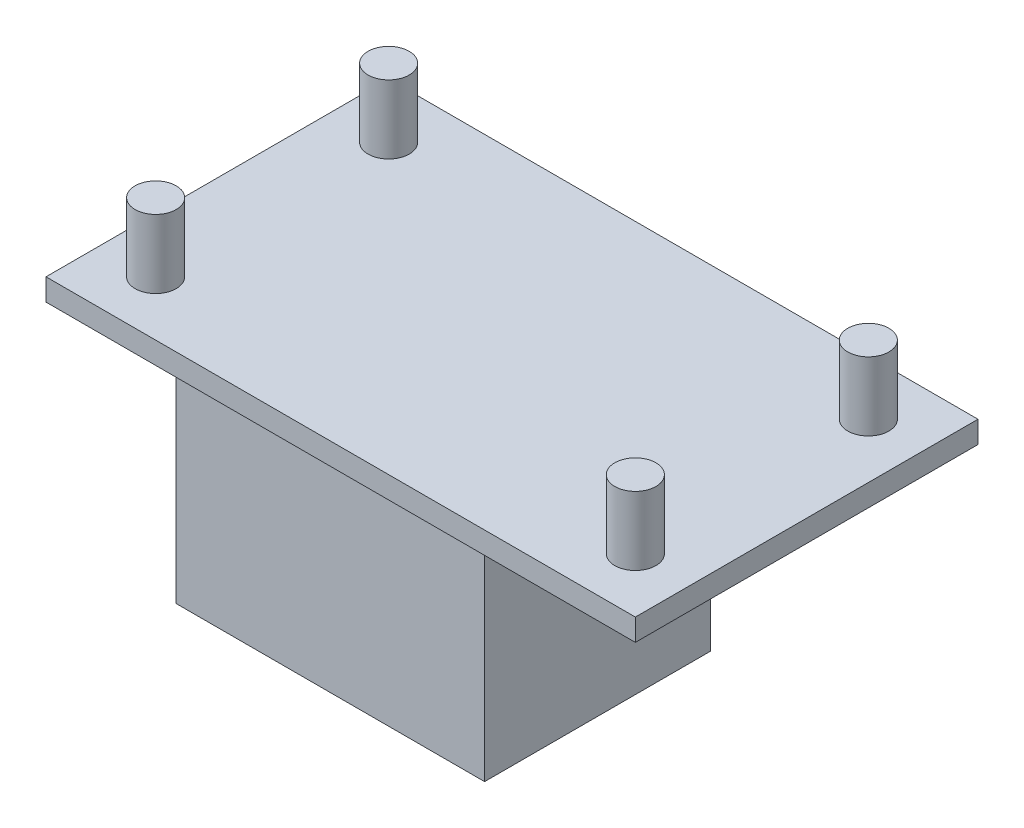
from build123d import *

# Parameters (mm, degrees)
P01_STANDOFF_START                = 20.4
SK_P01_STANDOFF_R                 = 1.5
P01_STANDOFF_DEPTH                = 5
P02_STANDOFF_START                = 20.4
SK_P02_STANDOFF_R                 = 1.5
P02_STANDOFF_DEPTH                = 5
P03_STANDOFF_START                = 20.4
SK_P03_STANDOFF_R                 = 1.5
P03_STANDOFF_DEPTH                = 5
P04_STANDOFF_START                = 20.4
SK_P04_STANDOFF_R                 = 1.5
P04_STANDOFF_DEPTH                = 5
P05_POLOLURCSWITCHWITHRELAY_START = 18.8
SK_P05_POLOLURCSWITCHWITHRELAY_W  = 43
SK_P05_POLOLURCSWITCHWITHRELAY_H  = 25
P05_POLOLURCSWITCHWITHRELAY_DEPTH = 1.6
SK_P06_RELAYG5LE_W                = 22.5
SK_P06_RELAYG5LE_H                = 16.5
P06_RELAYG5LE_DEPTH               = 18.8


with BuildPart() as part:
    # SK_P01_Standoff → P01_Standoff (new body)
    with BuildSketch(Plane(origin=(0, 0, 0), x_dir=(1, 0, 0), z_dir=(0, 1, 0)).offset(P01_STANDOFF_START)):
        with Locations(Location((-17.5, 8.5, 0), (0, 0, 270))):
            Circle(SK_P01_STANDOFF_R)
    extrude(amount=P01_STANDOFF_DEPTH)



with BuildPart() as body_2:
    # SK_P02_Standoff → P02_Standoff (new body)
    with BuildSketch(Plane(origin=(0, 0, 0), x_dir=(1, 0, 0), z_dir=(0, 1, 0)).offset(P02_STANDOFF_START)):
        with Locations(Location((-17.5, -8.5, 0), (0, 0, 270))):
            Circle(SK_P02_STANDOFF_R)
    extrude(amount=P02_STANDOFF_DEPTH)


with BuildPart() as body_3:
    # SK_P03_Standoff → P03_Standoff (new body)
    with BuildSketch(Plane(origin=(0, 0, 0), x_dir=(1, 0, 0), z_dir=(0, 1, 0)).offset(P03_STANDOFF_START)):
        with Locations(Location((17.5, 8.5, 0), (0, 0, 270))):
            Circle(SK_P03_STANDOFF_R)
    extrude(amount=P03_STANDOFF_DEPTH)


with BuildPart() as body_4:
    # SK_P04_Standoff → P04_Standoff (new body)
    with BuildSketch(Plane(origin=(0, 0, 0), x_dir=(1, 0, 0), z_dir=(0, 1, 0)).offset(P04_STANDOFF_START)):
        with Locations(Location((17.5, -8.5, 0), (0, 0, 270))):
            Circle(SK_P04_STANDOFF_R)
    extrude(amount=P04_STANDOFF_DEPTH)


with BuildPart() as part_1:
    add(part.part)

    add(body_2.part)  # P05_PololuRCswitchwithrelay merges body 2

    add(body_3.part)  # P05_PololuRCswitchwithrelay merges body 3

    add(body_4.part)  # P05_PololuRCswitchwithrelay merges body 4
    # SK_P05_PololuRCswitchwithrelay → P05_PololuRCswitchwithrelay (add)
    with BuildSketch(Plane(origin=(0, 0, 0), x_dir=(1, 0, 0), z_dir=(0, 1, 0)).offset(P05_POLOLURCSWITCHWITHRELAY_START)):
        Rectangle(SK_P05_POLOLURCSWITCHWITHRELAY_W, SK_P05_POLOLURCSWITCHWITHRELAY_H)
    extrude(amount=P05_POLOLURCSWITCHWITHRELAY_DEPTH)

    # SK_P06_RelayG5LE → P06_RelayG5LE (add)
    with BuildSketch(Plane(origin=(0, 0, 0), x_dir=(1, 0, 0), z_dir=(0, 1, 0))):
        with Locations((-5.25, 0.25)):
            Rectangle(SK_P06_RELAYG5LE_W, SK_P06_RELAYG5LE_H)
    extrude(amount=P06_RELAYG5LE_DEPTH)


solid = part_1.part
